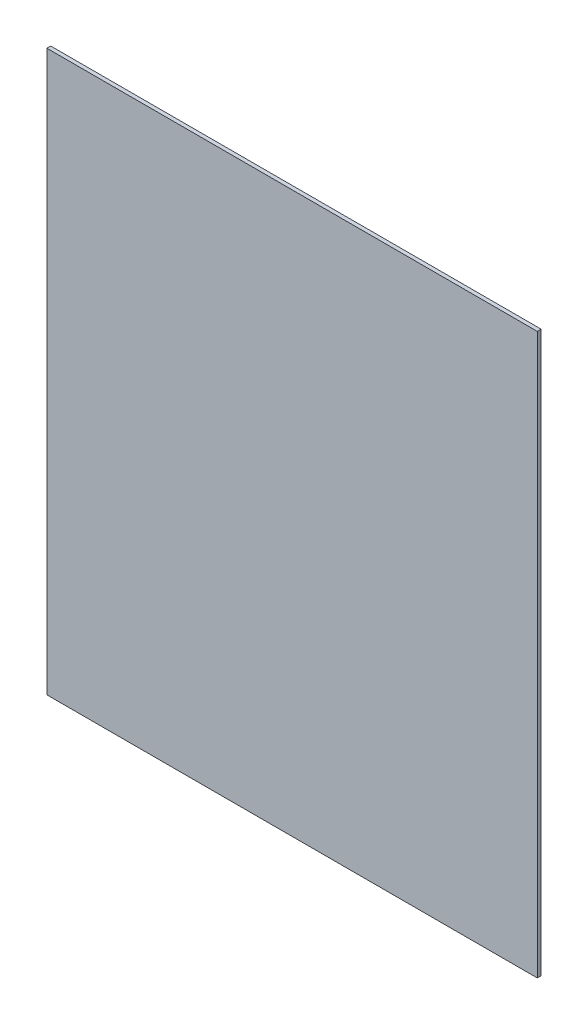
from build123d import *

# Parameters (mm, degrees)
ESQUISSE1_W        = 832
ESQUISSE1_H        = 950
BOSS_EXTRU_1_DEPTH = 6.5


with BuildPart() as part:
    # Esquisse1 → Boss.-Extru.1 (new body)
    with BuildSketch(Plane.XY):
        Rectangle(ESQUISSE1_W, ESQUISSE1_H)
    extrude(amount=BOSS_EXTRU_1_DEPTH)


solid = part.part
